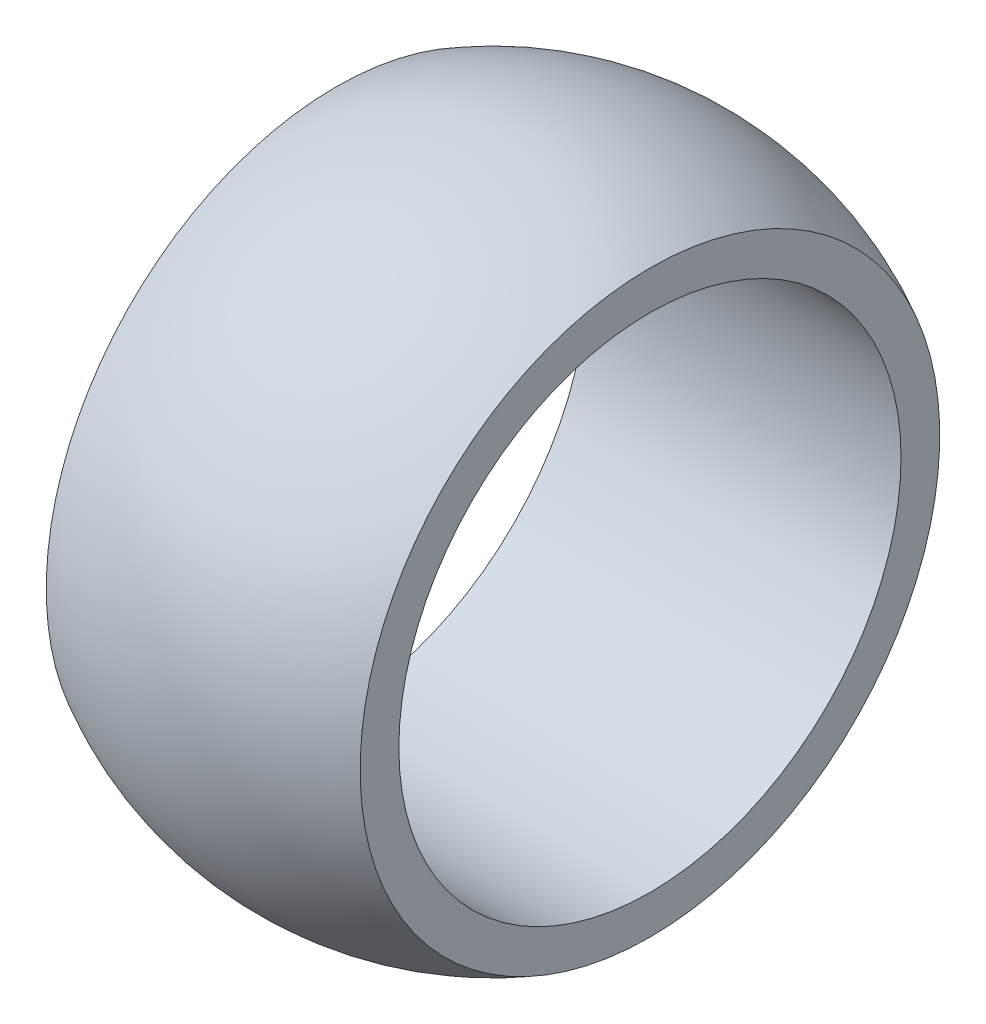
from build123d import *


with BuildPart() as part:
    # Esquisse1 → Base-Révolution (revolve)
    with BuildSketch(Plane.XY):
        with BuildLine():
            Line((2.5, 4.616546328), (2.5, 4))
            Line((2.5, 4), (-2.5, 4))
            Line((-2.5, 4), (-2.5, 4.616546328))
            ThreePointArc((-2.5, 4.616546328), (0, 5.25), (2.5, 4.616546328))
        make_face()
    revolve(axis=Axis((-124.153021442, 0, 0), (1, 0, 0)))


solid = part.part
